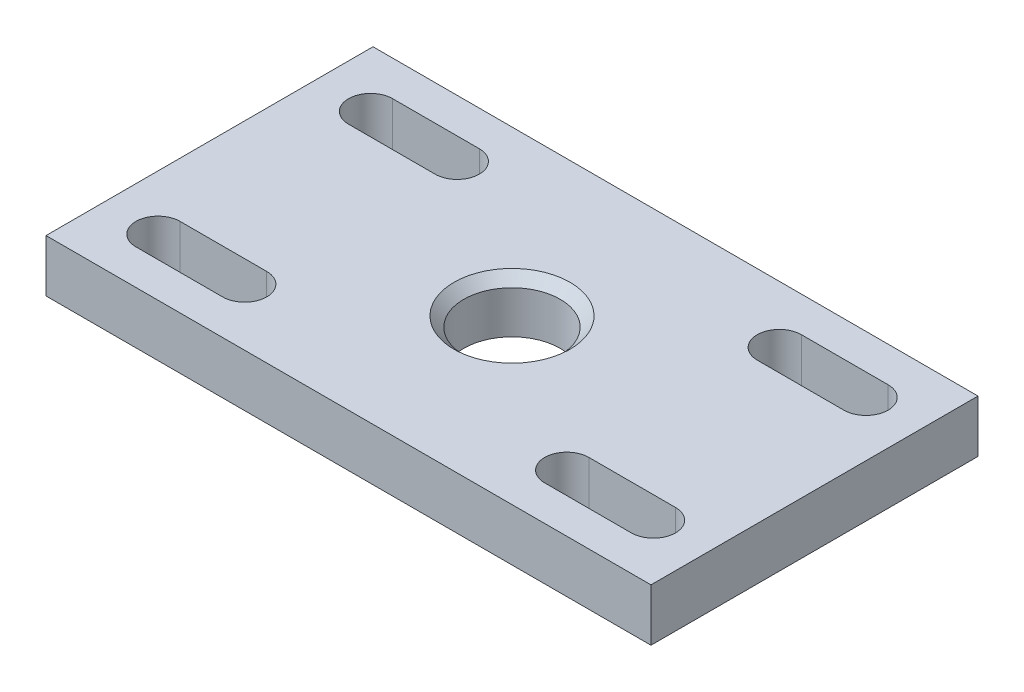
from build123d import *

# Parameters (mm, degrees)
SKETCH1_W               = 185
SKETCH1_H               = 100
BOSS_EXTRUDE1_DEPTH     = 16
CUT_EXTRUDE1_DEPTH      = 107.359061673
CUT_EXTRUDE1_DEPTH_BACK = 107.359061673
F_1_0MM_DOWEL_HOLE1_D   = 29.5
CHAMFER1_SIZE           = 3


with BuildPart() as part:
    # Sketch1 → Boss-Extrude1 (new body)
    with BuildSketch(Plane(origin=(0, 0, 0), x_dir=(1, 0, 0), z_dir=(0, 1, 0))):
        Rectangle(SKETCH1_W, SKETCH1_H)
    extrude(amount=BOSS_EXTRUDE1_DEPTH)

    # Sketch2 → Cut-Extrude1 (cut, two sides: drawn at the far end of the back side and taken through both)
    with BuildSketch(Plane(origin=(0, 16, 0), x_dir=(1, 0, 0), z_dir=(0, 1, 0)).offset(-CUT_EXTRUDE1_DEPTH_BACK)):
        with BuildLine():
            Line((-75.75, 39.25), (-49.25, 39.25))
            ThreePointArc((-49.25, 39.25), (-42.5, 32.5), (-49.25, 25.75))
            Line((-49.25, 25.75), (-75.75, 25.75))
            ThreePointArc((-75.75, 25.75), (-82.5, 32.5), (-75.75, 39.25))
        make_face()
        with BuildLine():
            Line((-49.25, -39.25), (-75.75, -39.25))
            ThreePointArc((-75.75, -39.25), (-82.5, -32.5), (-75.75, -25.75))
            Line((-75.75, -25.75), (-49.25, -25.75))
            ThreePointArc((-49.25, -25.75), (-42.5, -32.5), (-49.25, -39.25))
        make_face()
        with BuildLine():
            Line((49.25, 39.25), (75.75, 39.25))
            ThreePointArc((75.75, 39.25), (82.5, 32.5), (75.75, 25.75))
            Line((75.75, 25.75), (49.25, 25.75))
            ThreePointArc((49.25, 25.75), (42.5, 32.5), (49.25, 39.25))
        make_face()
        with BuildLine():
            Line((49.25, -25.75), (75.75, -25.75))
            ThreePointArc((75.75, -25.75), (82.5, -32.5), (75.75, -39.25))
            Line((75.75, -39.25), (49.25, -39.25))
            ThreePointArc((49.25, -39.25), (42.5, -32.5), (49.25, -25.75))
        make_face()
    extrude(amount=CUT_EXTRUDE1_DEPTH + CUT_EXTRUDE1_DEPTH_BACK, mode=Mode.SUBTRACT)

    # Ø1.0mm Dowel Hole1 (through all)
    with Locations(Plane(origin=(0, 16, 0), x_dir=(1, 0, 0), z_dir=(0, 1, 0))):
        with Locations((0, 0)):
            Hole(F_1_0MM_DOWEL_HOLE1_D / 2)

    # Chamfer1
    chamfer1_edges = [part.edges().sort_by_distance(p)[0] for p in [
        (14.75, 16, 0),
    ]]
    chamfer(chamfer1_edges, length=CHAMFER1_SIZE)


solid = part.part
